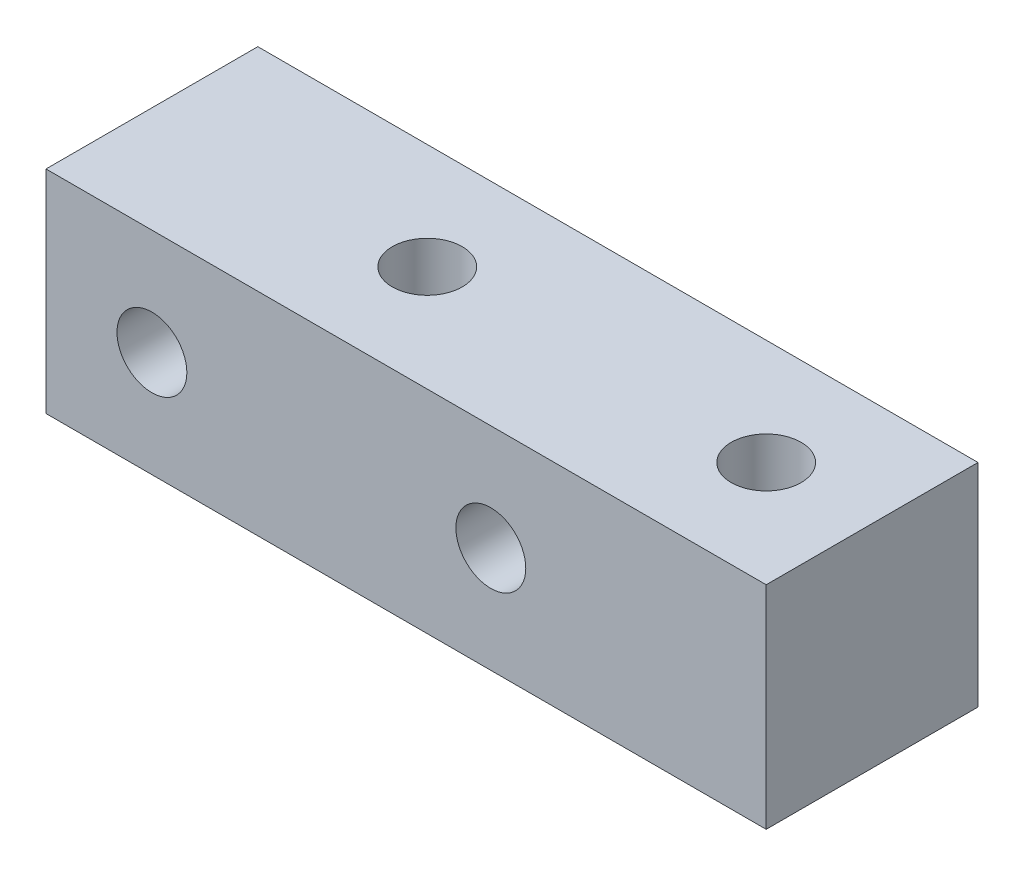
from build123d import *

# Parameters (mm, degrees)
SKETCH_1_W                   = 34
SKETCH_1_H                   = 10
EXTRUDE_1_DEPTH              = 10
HOLE_WIZARD_M4_1_D           = 3.3
HOLE_WIZARD_M4_1_ON_FACE_2_D = 3.3


with BuildPart() as part:
    # 草图1 → 凸台-拉伸1 (new body)
    with BuildSketch(Plane.XY):
        Rectangle(SKETCH_1_W, SKETCH_1_H)
    extrude(amount=EXTRUDE_1_DEPTH)

    # M4 螺纹孔的螺纹孔钻头1 (through all)
    with Locations(Plane(origin=(-4, 5, 5), x_dir=(1, 0, 0), z_dir=(0, 1, 0))):
        with Locations((0, 0), (16, 0)):
            Hole(HOLE_WIZARD_M4_1_D / 2)

    # M4 螺纹孔的螺纹孔钻头1 on face 2 (through all)
    with Locations(Plane(origin=(4, 0, 10), x_dir=(1, 0, 0), z_dir=(0, 0, 1))):
        with Locations((0, 0), (-16, 0)):
            Hole(HOLE_WIZARD_M4_1_ON_FACE_2_D / 2)


solid = part.part
